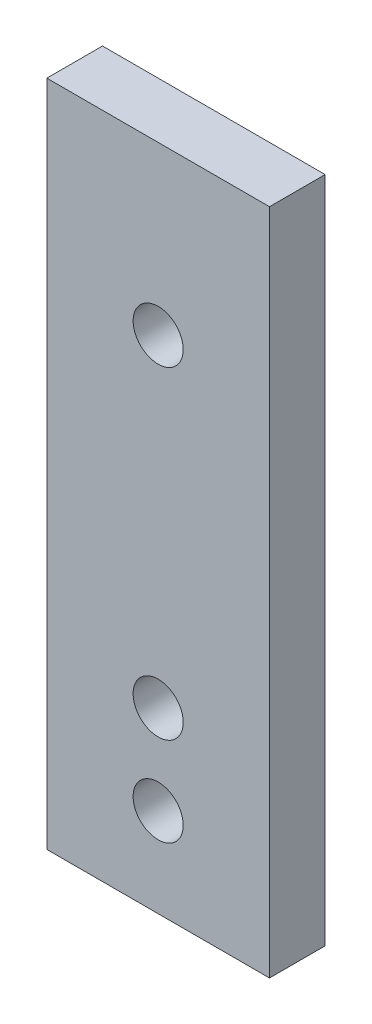
from build123d import *

# Parameters (mm, degrees)
SKETCH1_W           = 20
SKETCH1_H           = 60
SKETCH1_R           = 2.25
BOSS_EXTRUDE1_DEPTH = 5


with BuildPart() as part:
    # Sketch1 → Boss-Extrude1 (new body)
    with BuildSketch(Plane.XY):
        with Locations((10, 30)):
            Rectangle(SKETCH1_W, SKETCH1_H)
        with Locations((10, 45)):
            Circle(SKETCH1_R, mode=Mode.SUBTRACT)
        with Locations((10, 16)):
            Circle(SKETCH1_R, mode=Mode.SUBTRACT)
        with Locations((10, 8)):
            Circle(SKETCH1_R, mode=Mode.SUBTRACT)
    extrude(amount=BOSS_EXTRUDE1_DEPTH)


solid = part.part
